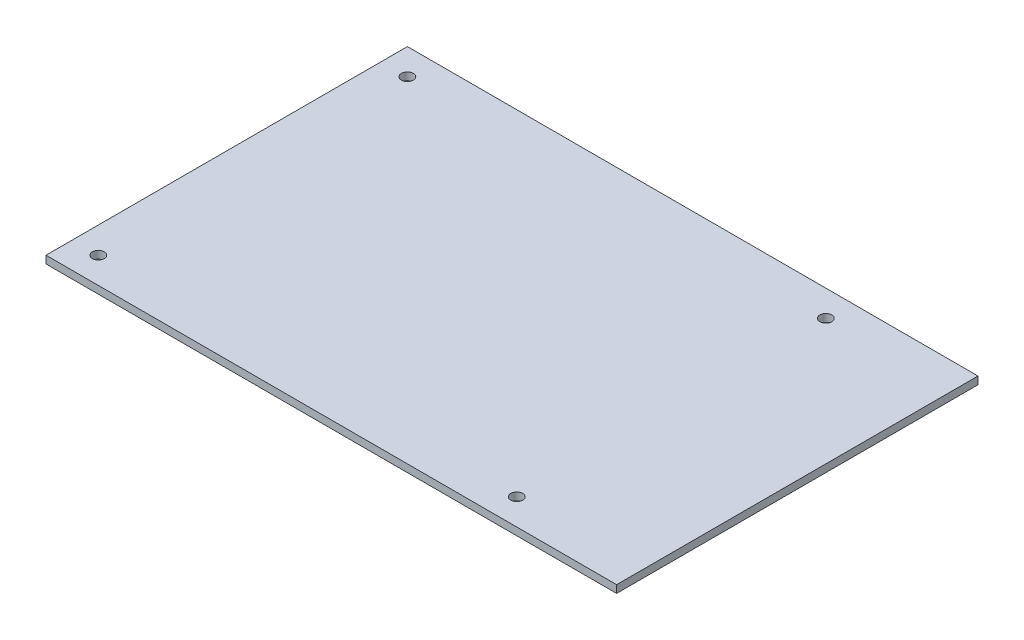
from build123d import *

# Parameters (mm, degrees)
SKETCH1_W           = 120
SKETCH1_H           = 76
BOSS_EXTRUDE1_DEPTH = 1.6
SKETCH2_R           = 1.25
CUT_EXTRUDE1_DEPTH  = 72.039144139


with BuildPart() as part:
    # Sketch1 → Boss-Extrude1 (new body)
    with BuildSketch(Plane(origin=(0, 0, 0), x_dir=(1, 0, 0), z_dir=(0, 1, 0))):
        Rectangle(SKETCH1_W, SKETCH1_H)
    extrude(amount=-BOSS_EXTRUDE1_DEPTH)

    # Sketch2 → Cut-Extrude1 (cut, through all)
    with BuildSketch(Plane(origin=(0, 0, 0), x_dir=(1, 0, 0), z_dir=(0, 1, 0))):
        with Locations(Location((-54.5, 32.5, 0), (0, 0, 270))):
            Circle(SKETCH2_R)
        with Locations(Location((-54.5, -32.5, 0), (0, 0, 270))):
            Circle(SKETCH2_R)
        with Locations(Location((33.5, 32.5, 0), (0, 0, 270))):
            Circle(SKETCH2_R)
        with Locations(Location((33.5, -32.5, 0), (0, 0, 270))):
            Circle(SKETCH2_R)
    extrude(amount=-CUT_EXTRUDE1_DEPTH, mode=Mode.SUBTRACT)


solid = part.part
